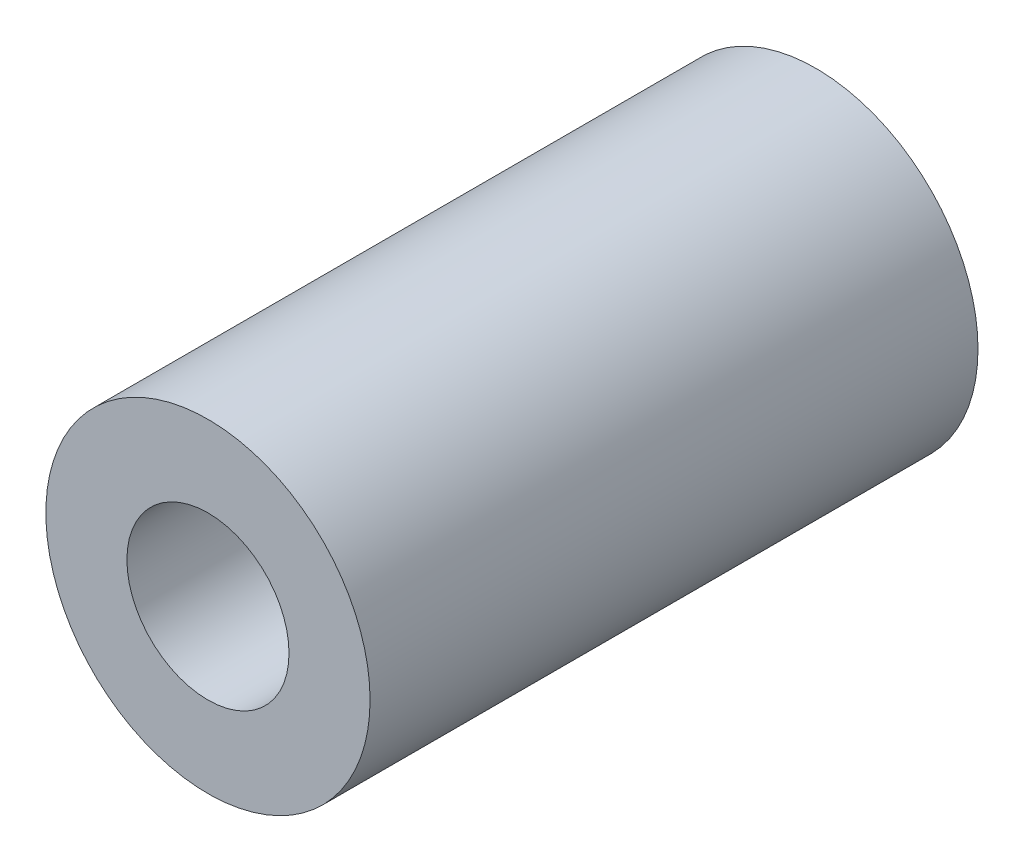
from build123d import *

# Parameters (mm, degrees)
SKETCH_1_R      = 4
SKETCH_1_R_2    = 2
EXTRUDE_1_DEPTH = 7.5


with BuildPart() as part:
    # 草图1 → 凸台-拉伸1 (new, symmetric)
    with BuildSketch(Plane.XY):
        Circle(SKETCH_1_R)
        Circle(SKETCH_1_R_2, mode=Mode.SUBTRACT)
    extrude(amount=EXTRUDE_1_DEPTH, both=True)


solid = part.part
